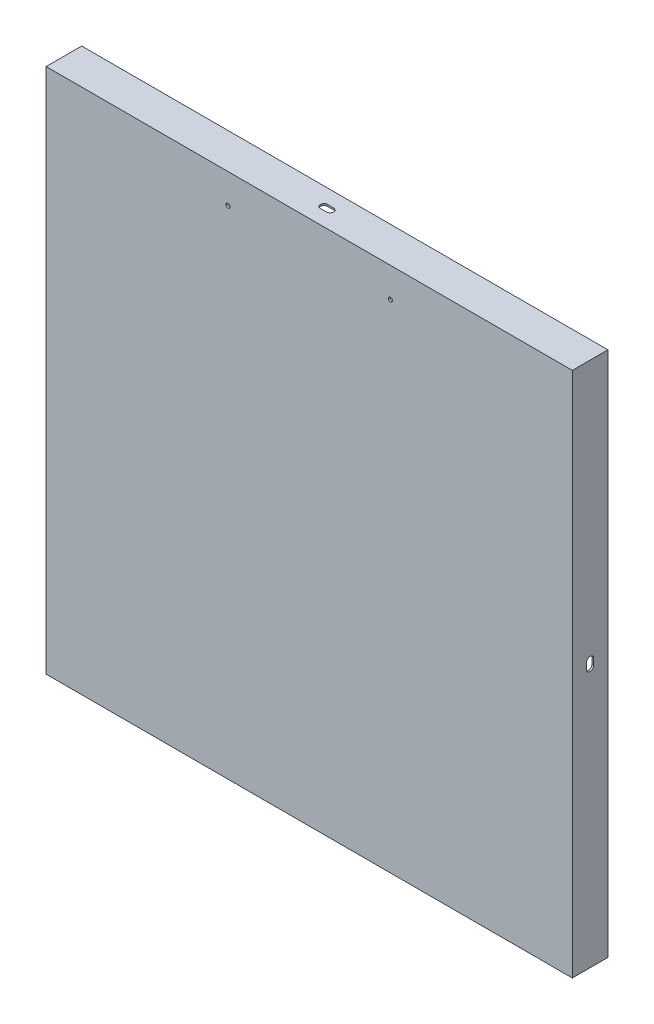
from build123d import *

# Parameters (mm, degrees)
SCHIZZO1_W                   = 444
SCHIZZO1_H                   = 444
ESTRUSIONE_ESTRUSIONE1_DEPTH = 30
SCHIZZO2_R                   = 1.7
TAGLIO_ESTRUSIONE1_DEPTH     = 629.627075459
SCHIZZO3_W                   = 441
SCHIZZO3_H                   = 441
TAGLIO_ESTRUSIONE2_DEPTH     = 28.5
TAGLIO_ESTRUSIONE3_DEPTH     = 629.627075459
TAGLIO_ESTRUSIONE4_DEPTH     = 629.627075459


with BuildPart() as part:
    # Schizzo1 → Estrusione-Estrusione1 (new body)
    with BuildSketch(Plane.XY):
        with Locations((222, 222)):
            Rectangle(SCHIZZO1_W, SCHIZZO1_H)
    extrude(amount=-ESTRUSIONE_ESTRUSIONE1_DEPTH)

    # Schizzo2 → Taglio-Estrusione1 (cut, through all)
    with BuildSketch(Plane(origin=(0, 0, -30), x_dir=(-1, 0, 0), z_dir=(0, 0, -1))):
        with Locations((-290.5, 419)):
            Circle(SCHIZZO2_R)
        with Locations((-153.5, 419)):
            Circle(SCHIZZO2_R)
    extrude(amount=-TAGLIO_ESTRUSIONE1_DEPTH, mode=Mode.SUBTRACT)

    # Schizzo3 → Taglio-Estrusione2 (cut)
    with BuildSketch(Plane(origin=(0, 0, -30), x_dir=(-1, 0, 0), z_dir=(0, 0, -1))):
        with Locations((-222, 222)):
            Rectangle(SCHIZZO3_W, SCHIZZO3_H)
    extrude(amount=-TAGLIO_ESTRUSIONE2_DEPTH, mode=Mode.SUBTRACT)

    # Schizzo4 → Taglio-Estrusione3 (cut, through all)
    with BuildSketch(Plane(origin=(0, 444, 0), x_dir=(1, 0, 0), z_dir=(0, 1, 0))):
        with BuildLine():
            Line((224.5, 12), (219.5, 12))
            ThreePointArc((219.5, 12), (216.5, 15), (219.5, 18))
            Line((219.5, 18), (224.5, 18))
            ThreePointArc((224.5, 18), (227.5, 15), (224.5, 12))
        make_face()
    extrude(amount=-TAGLIO_ESTRUSIONE3_DEPTH, mode=Mode.SUBTRACT)

    # Schizzo5 → Taglio-Estrusione4 (cut, through all)
    with BuildSketch(Plane.ZY):
        with BuildLine():
            Line((-12, 224.5), (-12, 219.5))
            ThreePointArc((-12, 219.5), (-15, 216.5), (-18, 219.5))
            Line((-18, 219.5), (-18, 224.5))
            ThreePointArc((-18, 224.5), (-15, 227.5), (-12, 224.5))
        make_face()
    extrude(amount=-TAGLIO_ESTRUSIONE4_DEPTH, mode=Mode.SUBTRACT)


solid = part.part
